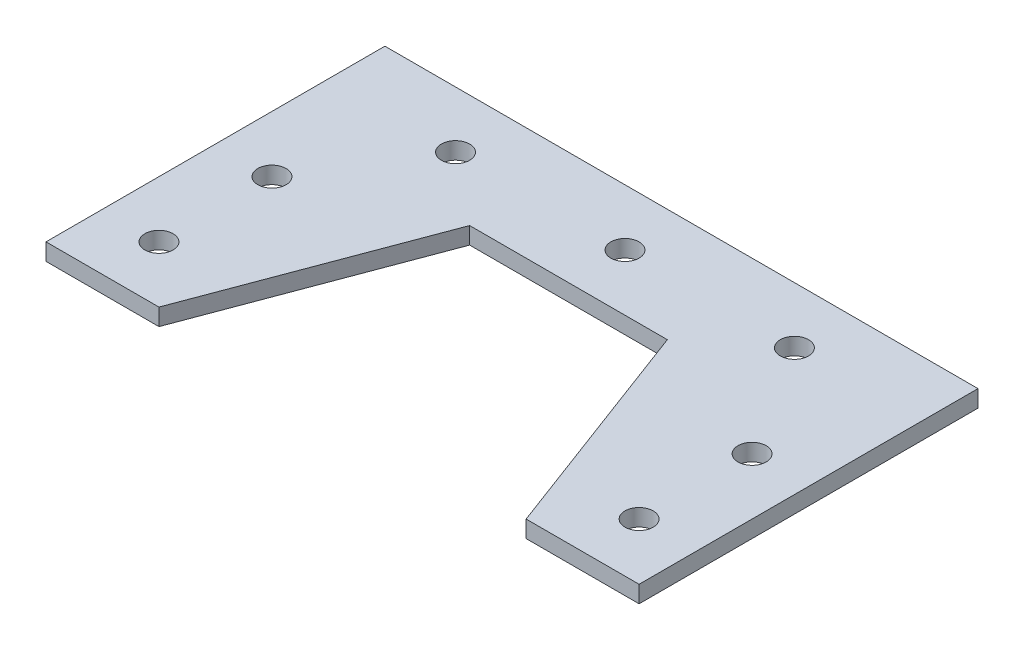
from build123d import *

# Parameters (mm, degrees)
BOSS_EXTRUDE1_DEPTH = 3
SKETCH2_R           = 2.5
CUT_EXTRUDE1_DEPTH  = 3


with BuildPart() as part:
    # Sketch1 → Boss-Extrude1 (new body)
    with BuildSketch(Plane(origin=(0, 0, 0), x_dir=(1, 0, 0), z_dir=(0, 1, 0))):
        Polygon((-52.5, 20), (52.5, 20), (52.5, -40), (32.5, -40), (17.5, 0), (-17.5, 0), (-32.5, -40), (-52.5, -40), align=None)
    extrude(amount=BOSS_EXTRUDE1_DEPTH)

    # Sketch2 → Cut-Extrude1 (cut)
    with BuildSketch(Plane(origin=(0, 3, 0), x_dir=(1, 0, 0), z_dir=(0, 1, 0))):
        with Locations(Location((42.5, -10, 0), (0, 0, 270))):
            Circle(SKETCH2_R)
        with Locations(Location((42.5, -30, 0), (0, 0, 270))):
            Circle(SKETCH2_R)
        with Locations(Location((-42.5, -30, 0), (0, 0, 270))):
            Circle(SKETCH2_R)
        with Locations(Location((0, 10, 0), (0, 0, 270))):
            Circle(SKETCH2_R)
        with Locations(Location((-42.5, -10, 0), (0, 0, 270))):
            Circle(SKETCH2_R)
        with Locations(Location((-30, 10, 0), (0, 0, 270))):
            Circle(SKETCH2_R)
        with Locations(Location((30, 10, 0), (0, 0, 270))):
            Circle(SKETCH2_R)
    extrude(amount=-CUT_EXTRUDE1_DEPTH, mode=Mode.SUBTRACT)


solid = part.part
